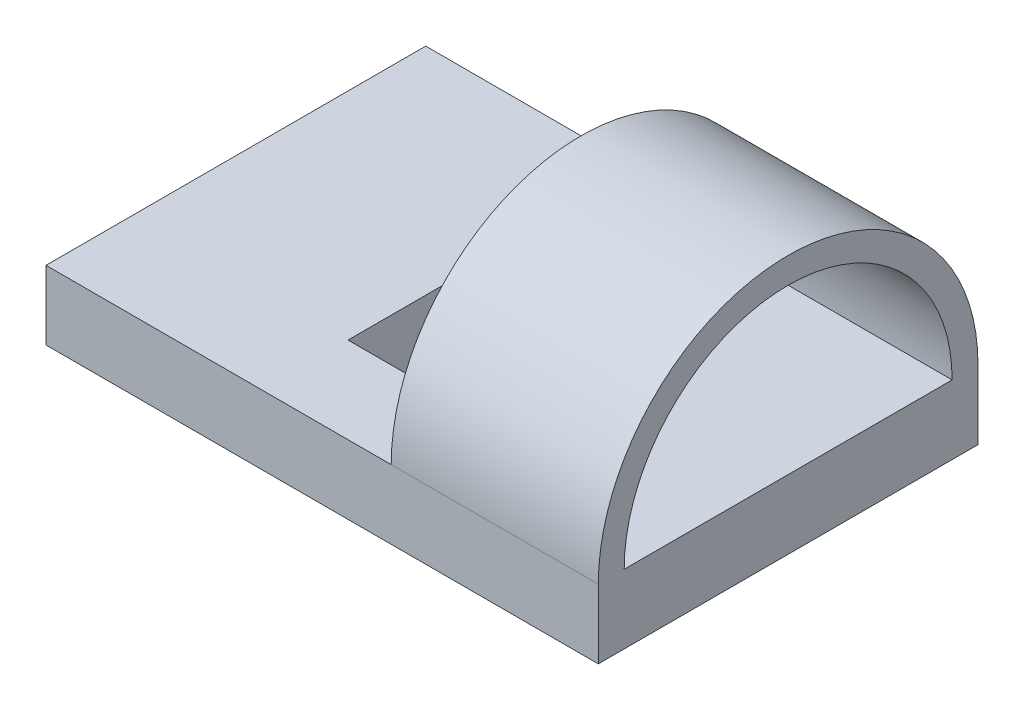
from build123d import *

# Parameters (mm, degrees)
SKETCH_1_W          = 16
SKETCH_1_H          = 11
EXTRUDE_1_DEPTH     = 2
EXTRUDE_START       = 2
EXTRUDE_2_DEPTH     = 6
SKETCH_3_W          = 3.5
SKETCH_3_H          = 6
CUT_EXTRUDE_1_DEPTH = 13.267844146


with BuildPart() as part:
    # 草图1 → 凸台-拉伸1 (new body)
    with BuildSketch(Plane(origin=(0, 0, 0), x_dir=(1, 0, 0), z_dir=(0, 1, 0))):
        Rectangle(SKETCH_1_W, SKETCH_1_H)
    extrude(amount=EXTRUDE_1_DEPTH)

    # 草图2 → 凸台-拉伸2 (add)
    with BuildSketch(Plane(origin=(0, 0, 0), x_dir=(0, 0, -1), z_dir=(1, 0, 0)).offset(EXTRUDE_START)):
        with BuildLine():
            Line((-5.5, 2), (-4.75, 2))
            ThreePointArc((-4.75, 2), (0, 6.75), (4.75, 2))
            Line((4.75, 2), (5.5, 2))
            ThreePointArc((5.5, 2), (0, 7.5), (-5.5, 2))
        make_face()
    extrude(amount=EXTRUDE_2_DEPTH)

    # 草图3 → 切除-拉伸1 (cut, through all)
    with BuildSketch(Plane.XZ):
        Rectangle(SKETCH_3_W, SKETCH_3_H)
    extrude(amount=-CUT_EXTRUDE_1_DEPTH, mode=Mode.SUBTRACT)


solid = part.part
